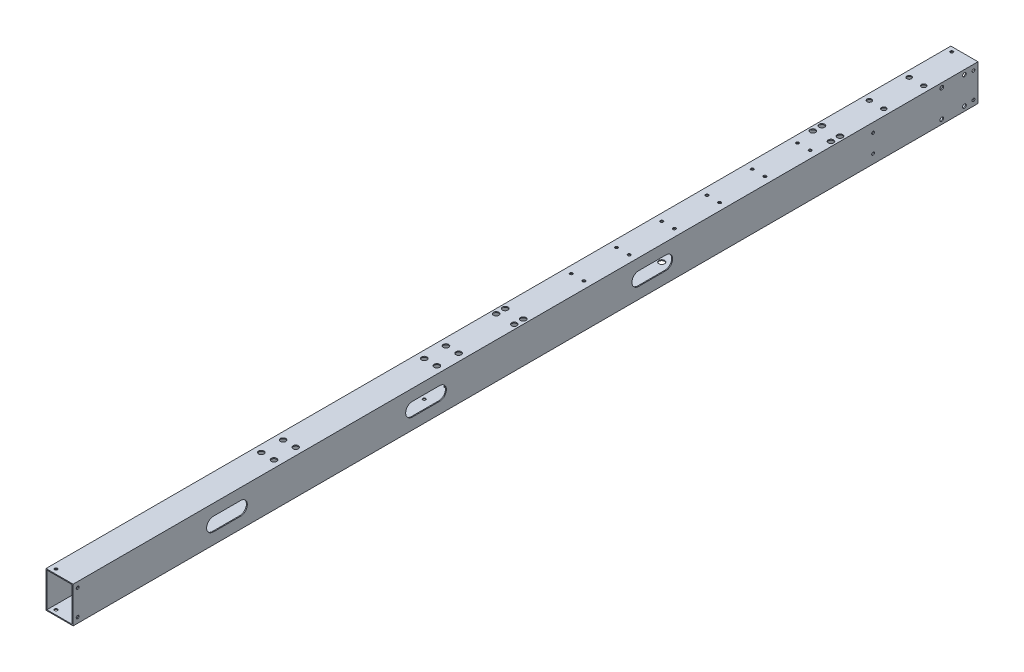
from build123d import *

# Parameters (mm, degrees)
SKETCH_1_W           = 30
SKETCH_1_H           = 40
SKETCH_1_W_2         = 28
SKETCH_1_H_2         = 38
EXTRUDE_1_DEPTH      = 1000
SKETCH_2_R           = 1.6
CUT_EXTRUDE_1_DEPTH  = 10
SKETCH_3_R           = 1.6
CUT_EXTRUDE_2_DEPTH  = 1001.912084051
SKETCH_5_R           = 2.6
CUT_EXTRUDE_3_DEPTH  = 1001.912084051
SKETCH_6_R           = 2.05
CUT_EXTRUDE_4_DEPTH  = 1
SKETCH_7_R           = 1.6
CUT_EXTRUDE_5_DEPTH  = 1
SKETCH_9_R           = 3
CUT_EXTRUDE_9_DEPTH  = 1
SKETCH_11_R          = 1.6
CUT_EXTRUDE_10_DEPTH = 1001.912084051
SKETCH_12_R          = 3.25
CUT_EXTRUDE_11_DEPTH = 1
SKETCH_16_R          = 3
CUT_EXTRUDE_15_DEPTH = 1
SKETCH_18_R          = 1.55
CUT_EXTRUDE_16_DEPTH = 10
SKETCH_21_R          = 1.6
CUT_EXTRUDE_18_DEPTH = 1001.912084051
SKETCH_23_R          = 1.55
CUT_EXTRUDE_19_DEPTH = 30


with BuildPart() as part:
    # 草图1 → 凸台-拉伸1 (new body)
    with BuildSketch(Plane.XY):
        Rectangle(SKETCH_1_W, SKETCH_1_H)
        Rectangle(SKETCH_1_W_2, SKETCH_1_H_2, mode=Mode.SUBTRACT)
    extrude(amount=EXTRUDE_1_DEPTH)

    # 草图2 → 切除-拉伸1 (cut)
    with BuildSketch(Plane(origin=(15, 0, 0), x_dir=(0, 0, -1), z_dir=(1, 0, 0))):
        with Locations((-995, 14)):
            Circle(SKETCH_2_R)
        with Locations((-995, -14)):
            Circle(SKETCH_2_R)
        with Locations((-5, 14)):
            Circle(SKETCH_2_R)
        with Locations((-5, -14)):
            Circle(SKETCH_2_R)
    extrude(amount=-CUT_EXTRUDE_1_DEPTH, mode=Mode.SUBTRACT)

    # 草图3 → 切除-拉伸2 (cut, through all)
    with BuildSketch(Plane(origin=(0, 20, 0), x_dir=(1, 0, 0), z_dir=(0, 1, 0))):
        with Locations(Location((-9, -995, 0), (0, 0, 270))):
            Circle(SKETCH_3_R)
        with Locations(Location((-9, -5, 0), (0, 0, 270))):
            Circle(SKETCH_3_R)
    extrude(amount=-CUT_EXTRUDE_2_DEPTH, mode=Mode.SUBTRACT)

    # 草图5 → 切除-拉伸3 (cut, through all)
    with BuildSketch(Plane.XZ.offset(20)):
        with Locations(Location((-8, 53, 0), (0, 0, 270))):
            Circle(SKETCH_5_R)
        with Locations(Location((8, 53, 0), (0, 0, 270))):
            Circle(SKETCH_5_R)
        with Locations(Location((-8, 97, 0), (0, 0, 270))):
            Circle(SKETCH_5_R)
        with Locations(Location((8, 97, 0), (0, 0, 270))):
            Circle(SKETCH_5_R)
    extrude(amount=-CUT_EXTRUDE_3_DEPTH, mode=Mode.SUBTRACT)

    # 草图6 → 切除-拉伸4 (cut)
    with BuildSketch(Plane(origin=(15, 0, 0), x_dir=(0, 0, -1), z_dir=(1, 0, 0))):
        with Locations((-40, 15)):
            Circle(SKETCH_6_R)
        with Locations((-15, 15)):
            Circle(SKETCH_6_R)
        with Locations((-15, -15)):
            Circle(SKETCH_6_R)
        with Locations((-40, -15)):
            Circle(SKETCH_6_R)
        with BuildLine():
            Line((-345, -7.5), (-375, -7.5))
            ThreePointArc((-375, -7.5), (-382.5, 0), (-375, 7.5))
            Line((-375, 7.5), (-345, 7.5))
            ThreePointArc((-345, 7.5), (-337.5, 0), (-345, -7.5))
        make_face()
        with BuildLine():
            Line((-595, -7.5), (-625, -7.5))
            ThreePointArc((-625, -7.5), (-632.5, 0), (-625, 7.5))
            Line((-625, 7.5), (-595, 7.5))
            ThreePointArc((-595, 7.5), (-587.5, 0), (-595, -7.5))
        make_face()
        with BuildLine():
            Line((-815, -7.5), (-845, -7.5))
            ThreePointArc((-845, -7.5), (-852.5, 0), (-845, 7.5))
            Line((-845, 7.5), (-815, 7.5))
            ThreePointArc((-815, 7.5), (-807.5, 0), (-815, -7.5))
        make_face()
    extrude(amount=-CUT_EXTRUDE_4_DEPTH, mode=Mode.SUBTRACT)

    # 草图7 → 切除-拉伸5 (cut)
    with BuildSketch(Plane.ZY.offset(15)):
        with Locations((350, 0)):
            Circle(SKETCH_7_R)
        with Locations((370, 0)):
            Circle(SKETCH_7_R)
        with Locations((600, 0)):
            Circle(SKETCH_7_R)
        with Locations((620, 0)):
            Circle(SKETCH_7_R)
        with Locations((850, 0)):
            Circle(SKETCH_7_R)
        with Locations((870, 0)):
            Circle(SKETCH_7_R)
    extrude(amount=-CUT_EXTRUDE_5_DEPTH, mode=Mode.SUBTRACT)

    # 草图9 → 切除-拉伸9 (cut)
    with BuildSketch(Plane(origin=(0, 20, 0), x_dir=(1, 0, 0), z_dir=(0, 1, 0))):
        with Locations(Location((-10, -507.5, 0), (0, 0, 270))):
            Circle(SKETCH_9_R)
        with Locations(Location((-10, -497.5, 0), (0, 0, 270))):
            Circle(SKETCH_9_R)
        with Locations(Location((10, -497.5, 0), (0, 0, 270))):
            Circle(SKETCH_9_R)
        with Locations(Location((10, -507.5, 0), (0, 0, 270))):
            Circle(SKETCH_9_R)
        with Locations(Location((-10, -147.5, 0), (0, 0, 270))):
            Circle(SKETCH_9_R)
        with Locations(Location((-10, -157.5, 0), (0, 0, 270))):
            Circle(SKETCH_9_R)
        with Locations(Location((10, -157.5, 0), (0, 0, 270))):
            Circle(SKETCH_9_R)
        with Locations(Location((10, -147.5, 0), (0, 0, 270))):
            Circle(SKETCH_9_R)
    extrude(amount=-CUT_EXTRUDE_9_DEPTH, mode=Mode.SUBTRACT)

    # 草图11 → 切除-拉伸10 (cut, through all)
    with BuildSketch(Plane(origin=(0, 20, 0), x_dir=(1, 0, 0), z_dir=(0, 1, 0))):
        with Locations(Location((-7, -177.5, 0), (0, 0, 270))):
            Circle(SKETCH_11_R)
        with Locations(Location((7, -177.5, 0), (0, 0, 270))):
            Circle(SKETCH_11_R)
        with Locations(Location((-7, -227.5, 0), (0, 0, 270))):
            Circle(SKETCH_11_R)
        with Locations(Location((7, -227.5, 0), (0, 0, 270))):
            Circle(SKETCH_11_R)
        with Locations(Location((-7, -277.5, 0), (0, 0, 270))):
            Circle(SKETCH_11_R)
        with Locations(Location((7, -277.5, 0), (0, 0, 270))):
            Circle(SKETCH_11_R)
        with Locations(Location((-7, -327.5, 0), (0, 0, 270))):
            Circle(SKETCH_11_R)
        with Locations(Location((7, -327.5, 0), (0, 0, 270))):
            Circle(SKETCH_11_R)
        with Locations(Location((-7, -377.5, 0), (0, 0, 270))):
            Circle(SKETCH_11_R)
        with Locations(Location((7, -377.5, 0), (0, 0, 270))):
            Circle(SKETCH_11_R)
        with Locations(Location((-7, -427.5, 0), (0, 0, 270))):
            Circle(SKETCH_11_R)
        with Locations(Location((7, -427.5, 0), (0, 0, 270))):
            Circle(SKETCH_11_R)
    extrude(amount=-CUT_EXTRUDE_10_DEPTH, mode=Mode.SUBTRACT)

    # 草图12 → 切除-拉伸11 (cut)
    with BuildSketch(Plane.XZ.offset(20)):
        with Locations(Location((-7, 227.5, 0), (0, 0, 270))):
            Circle(SKETCH_12_R)
        with Locations(Location((7, 227.5, 0), (0, 0, 270))):
            Circle(SKETCH_12_R)
        with Locations(Location((-7, 277.5, 0), (0, 0, 270))):
            Circle(SKETCH_12_R)
        with Locations(Location((7, 277.5, 0), (0, 0, 270))):
            Circle(SKETCH_12_R)
        with Locations(Location((-7, 327.5, 0), (0, 0, 270))):
            Circle(SKETCH_12_R)
        with Locations(Location((-7, 177.5, 0), (0, 0, 270))):
            Circle(SKETCH_12_R)
        with Locations(Location((7, 177.5, 0), (0, 0, 270))):
            Circle(SKETCH_12_R)
        with Locations(Location((7, 327.5, 0), (0, 0, 270))):
            Circle(SKETCH_12_R)
        with Locations(Location((-7, 377.5, 0), (0, 0, 270))):
            Circle(SKETCH_12_R)
        with Locations(Location((7, 377.5, 0), (0, 0, 270))):
            Circle(SKETCH_12_R)
        with Locations(Location((-7, 427.5, 0), (0, 0, 270))):
            Circle(SKETCH_12_R)
        with Locations(Location((7, 427.5, 0), (0, 0, 270))):
            Circle(SKETCH_12_R)
    extrude(amount=-CUT_EXTRUDE_11_DEPTH, mode=Mode.SUBTRACT)

    # 草图16 → 切除-拉伸15 (cut)
    with BuildSketch(Plane(origin=(0, 20, 0), x_dir=(1, 0, 0), z_dir=(0, 1, 0))):
        with Locations(Location((-7, -770, 0), (0, 0, 270))):
            Circle(SKETCH_16_R)
        with Locations(Location((7, -770, 0), (0, 0, 270))):
            Circle(SKETCH_16_R)
        with Locations(Location((-7, -590, 0), (0, 0, 270))):
            Circle(SKETCH_16_R)
        with Locations(Location((-7, -746, 0), (0, 0, 270))):
            Circle(SKETCH_16_R)
        with Locations(Location((7, -590, 0), (0, 0, 270))):
            Circle(SKETCH_16_R)
        with Locations(Location((7, -746, 0), (0, 0, 270))):
            Circle(SKETCH_16_R)
        with Locations(Location((7, -566, 0), (0, 0, 270))):
            Circle(SKETCH_16_R)
        with Locations(Location((-7, -566, 0), (0, 0, 270))):
            Circle(SKETCH_16_R)
    extrude(amount=-CUT_EXTRUDE_15_DEPTH, mode=Mode.SUBTRACT)

    # 草图18 → 切除-拉伸16 (cut)
    with BuildSketch(Plane.XZ.offset(20)):
        with Locations(Location((-7, 770, 0), (0, 0, 270))):
            Circle(SKETCH_18_R)
        with Locations(Location((7, 770, 0), (0, 0, 270))):
            Circle(SKETCH_18_R)
        with Locations(Location((-7, 746, 0), (0, 0, 270))):
            Circle(SKETCH_18_R)
        with Locations(Location((7, 746, 0), (0, 0, 270))):
            Circle(SKETCH_18_R)
    extrude(amount=-CUT_EXTRUDE_16_DEPTH, mode=Mode.SUBTRACT)

    # 草图21 → 切除-拉伸18 (cut, through all)
    with BuildSketch(Plane.XZ.offset(20)):
        with Locations(Location((-10, 147.5, 0), (0, 0, 270))):
            Circle(SKETCH_21_R)
        with Locations(Location((-10, 157.5, 0), (0, 0, 270))):
            Circle(SKETCH_21_R)
        with Locations(Location((10, 147.5, 0), (0, 0, 270))):
            Circle(SKETCH_21_R)
        with Locations(Location((10, 157.5, 0), (0, 0, 270))):
            Circle(SKETCH_21_R)
        with Locations(Location((-10, 497.5, 0), (0, 0, 270))):
            Circle(SKETCH_21_R)
        with Locations(Location((-10, 507.5, 0), (0, 0, 270))):
            Circle(SKETCH_21_R)
        with Locations(Location((10, 497.5, 0), (0, 0, 270))):
            Circle(SKETCH_21_R)
        with Locations(Location((10, 507.5, 0), (0, 0, 270))):
            Circle(SKETCH_21_R)
        with Locations(Location((-7, 566, 0), (0, 0, 270))):
            Circle(SKETCH_21_R)
        with Locations(Location((-7, 590, 0), (0, 0, 270))):
            Circle(SKETCH_21_R)
        with Locations(Location((7, 566, 0), (0, 0, 270))):
            Circle(SKETCH_21_R)
        with Locations(Location((7, 590, 0), (0, 0, 270))):
            Circle(SKETCH_21_R)
        with Locations(Location((-7, 746, 0), (0, 0, 270))):
            Circle(SKETCH_21_R)
        with Locations(Location((-7, 770, 0), (0, 0, 270))):
            Circle(SKETCH_21_R)
        with Locations(Location((7, 746, 0), (0, 0, 270))):
            Circle(SKETCH_21_R)
        with Locations(Location((7, 770, 0), (0, 0, 270))):
            Circle(SKETCH_21_R)
    extrude(amount=-CUT_EXTRUDE_18_DEPTH, mode=Mode.SUBTRACT)

    # 草图23 → 切除-拉伸19 (cut)
    with BuildSketch(Plane(origin=(15, 0, 0), x_dir=(0, 0, -1), z_dir=(1, 0, 0))):
        with Locations((-116, 10)):
            Circle(SKETCH_23_R)
        with Locations((-116, -10)):
            Circle(SKETCH_23_R)
    extrude(amount=-CUT_EXTRUDE_19_DEPTH, mode=Mode.SUBTRACT)


solid = part.part
